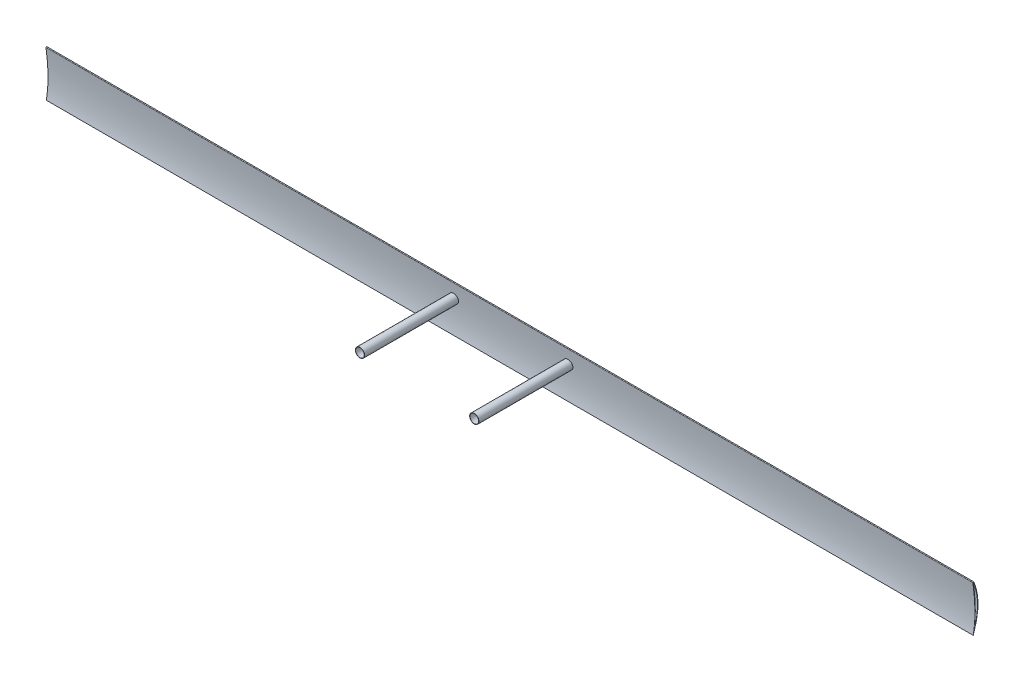
from build123d import *

# Parameters (mm, degrees)
EXTRUDE_1_DEPTH             = 1500
EXTRUDE_1_DEPTH_BACK        = 1500
EXTRUDE_2_REACH             = 1520.673
SKETCH_3_R                  = 15
SKETCH_3_R_2                = 14
EXTRUDE_2_DIRECTION_2_DEPTH = 100


with BuildPart() as part:
    # 草圖2 → 填料-伸長1 (new, two sides: drawn at the far end of the back side and taken through both)
    with BuildSketch(Plane(origin=(0, 0, 0), x_dir=(0, 0, -1), z_dir=(1, 0, 0)).offset(-EXTRUDE_1_DEPTH_BACK)):
        with BuildLine():
            ThreePointArc((-1.088593129, 48.359887349), (0.024079781, 50.006426178), (1.794443126, 49.103683277))
            add(Edge.make_bspline(
                [(1.794443126, 49.103683277), (21.896135798, -1.933092604), (18.194917747, -45.134648614), (0, -100)],
                knots=[0, 0, 0, 0, 1, 1, 1, 1], degree=3))
            add(Edge.make_bspline(
                [(-1.088593129, 48.359887349), (5.344765184, -0.939769616), (9.700500238, -50.058525982), (0, -100)],
                knots=[0, 0, 0, 0, 1, 1, 1, 1], degree=3))
        make_face()
        with BuildLine():
            ThreePointArc((0.84696955, 48.775660675), (0.238201391, 49.027491701), (-0.091763263, 48.457280455))
            add(Edge.make_bspline(
                [(-0.091763263, 48.457280455), (0.998519249, 42.926488495), (9.15197505, -17.127162666), (5.809771684, -70.689105238), (3.653495177, -85.067751619)],
                knots=[0, 0, 0, 0, 0.343393105, 1, 1, 1, 1], degree=3))
            add(Edge.make_bspline(
                [(0.84696955, 48.775660675), (2.672213644, 45.08548086), (23.000728478, -18.038357404), (8.140334407, -68.076591074), (3.653495177, -85.067751619)],
                knots=[0, 0, 0, 0, 0.343941904, 1, 1, 1, 1], degree=3))
        make_face(mode=Mode.SUBTRACT)
    extrude(amount=EXTRUDE_1_DEPTH + EXTRUDE_1_DEPTH_BACK)

    # 草圖3 → 填料-伸長2 (add, up to next)
    with BuildSketch(Plane.XY.offset(200), mode=Mode.PRIVATE) as extrude_2_sk1:
        with Locations(Location((185, 0, 0), (0, 0, 180))):
            Circle(SKETCH_3_R)
        with Locations((185, 0)):
            Circle(SKETCH_3_R_2, mode=Mode.SUBTRACT)
    extrude_2_tool1 = extrude(extrude_2_sk1.sketch, amount=-EXTRUDE_2_REACH, mode=Mode.PRIVATE) - part.part
    # 草圖3 → 填料-伸長2 (add, up to next)
    with BuildSketch(Plane.XY.offset(200), mode=Mode.PRIVATE) as extrude_2_sk2:
        with Locations(Location((-185, 0, 0), (0, 0, 180))):
            Circle(SKETCH_3_R)
        with Locations((-185, 0)):
            Circle(SKETCH_3_R_2, mode=Mode.SUBTRACT)
    extrude_2_tool2 = extrude(extrude_2_sk2.sketch, amount=-EXTRUDE_2_REACH, mode=Mode.PRIVATE) - part.part
    add(extrude_2_tool1.solids().sort_by_distance((199.575736, 0, 200))[0])
    add(extrude_2_tool2.solids().sort_by_distance((-170.424264, 0, 200))[0])

    # 草圖3 → 填料-伸長2 direction 2 (add)
    # profile 1 of 2: a face of its own
    with BuildSketch(Plane.XY.offset(200)):
        with Locations(Location((185, 0, 0), (0, 0, 180))):
            Circle(SKETCH_3_R)
        with Locations((185, 0)):
            Circle(SKETCH_3_R_2, mode=Mode.SUBTRACT)
    # profile 2 of 2: a face of its own
    with BuildSketch(Plane.XY.offset(200)):
        with Locations(Location((-185, 0, 0), (0, 0, 180))):
            Circle(SKETCH_3_R)
        with Locations((-185, 0)):
            Circle(SKETCH_3_R_2, mode=Mode.SUBTRACT)
    extrude(amount=EXTRUDE_2_DIRECTION_2_DEPTH)


solid = part.part
